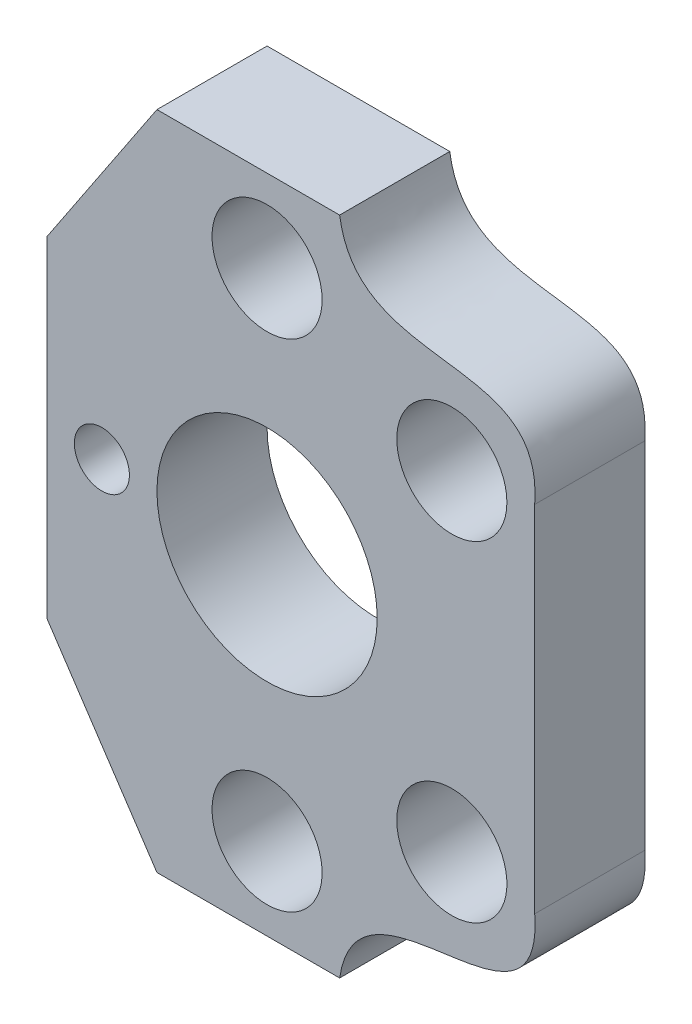
from build123d import *

# Parameters (mm, degrees)
SKETCH1_R           = 10
SKETCH1_R_2         = 2.5
SKETCH1_R_3         = 5
BOSS_EXTRUDE1_DEPTH = 10


with BuildPart() as part:
    # Sketch1 → Boss-Extrude1 (new body)
    with BuildSketch(Plane.XY):
        with BuildLine():
            Line((-20, -22.406552459), (-20, 7.593447541))
            Line((-20, 7.593447541), (-10, 22.593447541))
            Line((-10, 22.593447541), (0, 22.593447541))
            Line((0, 22.593447541), (6.589653899, 22.593447541))
            add(Edge.make_bspline(
                [(6.589653899, 22.593447541), (8.279830639, 11.435624487), (25.165546695, 20.477646142), (24.304134066, 8.692145069)],
                knots=[0, 0, 0, 0, 1, 1, 1, 1], degree=3))
            Line((24.304134066, 8.692145069), (24.304134066, -23.505249987))
            add(Edge.make_bspline(
                [(6.589653899, -37.406552459), (8.279830639, -26.248729405), (25.165546695, -35.290751061), (24.304134066, -23.505249987)],
                knots=[0, 0, 0, 0, 1, 1, 1, 1], degree=3))
            Line((6.589653899, -37.406552459), (0, -37.406552459))
            Line((0, -37.406552459), (-10, -37.406552459))
            Line((-10, -37.406552459), (-20, -22.406552459))
        make_face()
        with Locations(Location((0, -7.406552459, 0), (0, 0, 180))):
            Circle(SKETCH1_R, mode=Mode.SUBTRACT)
        with Locations((-15, -7.406552459)):
            Circle(SKETCH1_R_2, mode=Mode.SUBTRACT)
        with Locations((0, 15.12355642)):
            Circle(SKETCH1_R_3, mode=Mode.SUBTRACT)
        with Locations((16.779399128, 7.593447541)):
            Circle(SKETCH1_R_3, mode=Mode.SUBTRACT)
        with Locations(Location((0, -29.936661338, 0), (0, 0, 180))):
            Circle(SKETCH1_R_3, mode=Mode.SUBTRACT)
        with Locations(Location((16.779399128, -22.406552459, 0), (0, 0, 180))):
            Circle(SKETCH1_R_3, mode=Mode.SUBTRACT)
    extrude(amount=BOSS_EXTRUDE1_DEPTH)


solid = part.part
